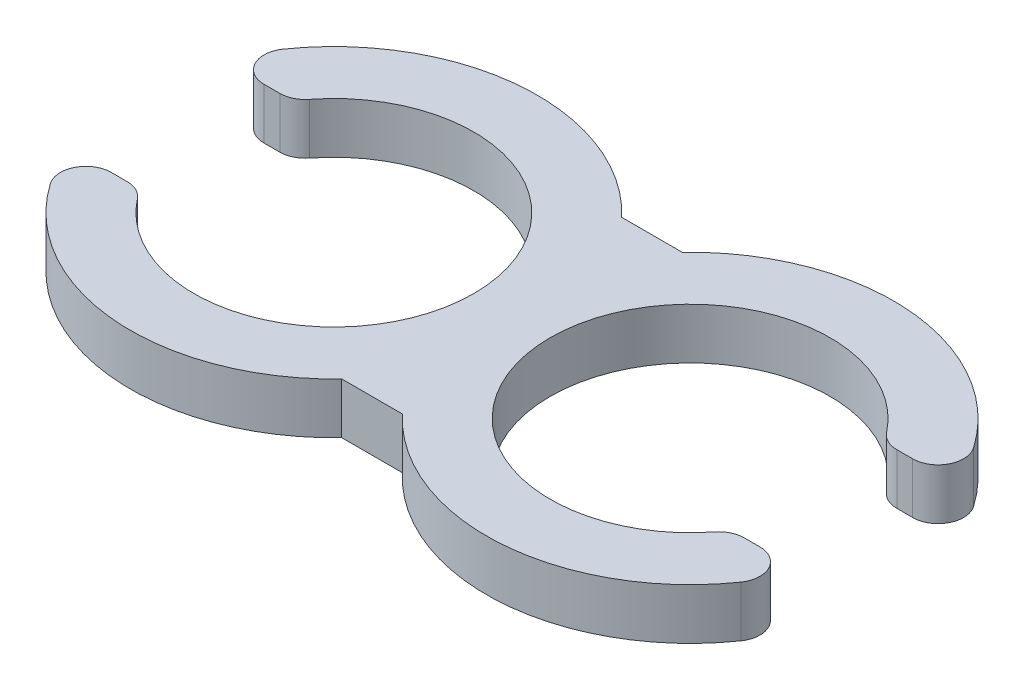
from build123d import *

# Parameters (mm, degrees)
BOSS_EXTRUDE1_DEPTH = 2
FILLET1_R           = 1
FILLET2_R           = 1


with BuildPart() as part:
    # Sketch1 → Boss-Extrude1 (new body)
    with BuildSketch(Plane(origin=(0, 0, 0), x_dir=(1, 0, 0), z_dir=(0, 1, 0))):
        with BuildLine():
            Line((11.609772229, 3), (14.416198487, 3))
            ThreePointArc((14.416198487, 3), (9.671814624, 7.540650278), (3.127016654, 7))
            Line((3.127016654, 7), (3.127016654, 5.5))
            Line((3.127016654, 5.5), (7, 5.5))
            ThreePointArc((7, 5.5), (9.62202212, 4.834769901), (11.609772229, 3))
        make_face()
        with BuildLine():
            Line((3.127016654, -5.5), (3.127016654, -7))
            ThreePointArc((3.127016654, -7), (9.671814624, -7.540650278), (14.416198487, -3))
            Line((14.416198487, -3), (11.609772229, -3))
            ThreePointArc((11.609772229, -3), (9.62202212, -4.834769901), (7, -5.5))
            Line((7, -5.5), (3.127016654, -5.5))
        make_face()
        with BuildLine():
            Line((3.127016654, -5.5), (1.190524981, -5.5))
            ThreePointArc((1.190524981, -5.5), (2.101020514, -6.32455532), (3.127016654, -7))
            Line((3.127016654, -7), (3.127016654, -5.5))
        make_face()
        with BuildLine():
            ThreePointArc((0, -3.872983346), (0.543804652, -4.72414454), (1.190524981, -5.5))
            Line((1.190524981, -5.5), (3.127016654, -5.5))
            Line((3.127016654, -5.5), (3.127016654, -3.905124838))
            ThreePointArc((3.127016654, -3.905124838), (2.734545947, -3.472160958), (2.390227771, -3))
            Line((2.390227771, -3), (0.416198487, -3))
            ThreePointArc((0.416198487, -3), (0.221303185, -3.442786708), (0, -3.872983346))
        make_face()
        with BuildLine():
            ThreePointArc((1, 0), (0.85269342, -1.5281381), (0.416198487, -3))
            Line((0.416198487, -3), (2.390227771, -3))
            ThreePointArc((2.390227771, -3), (1.5, 0), (2.390227771, 3))
            Line((2.390227771, 3), (0.416198487, 3))
            ThreePointArc((0.416198487, 3), (0.85269342, 1.5281381), (1, 0))
        make_face()
        with BuildLine():
            ThreePointArc((0, 3.872983346), (0.221303185, 3.442786708), (0.416198487, 3))
            Line((0.416198487, 3), (2.390227771, 3))
            ThreePointArc((2.390227771, 3), (2.734545947, 3.472160958), (3.127016654, 3.905124838))
            Line((3.127016654, 3.905124838), (3.127016654, 5.5))
            Line((3.127016654, 5.5), (1.190524981, 5.5))
            ThreePointArc((1.190524981, 5.5), (0.543804652, 4.72414454), (0, 3.872983346))
        make_face()
        with BuildLine():
            Line((1.190524981, 5.5), (-1.190524981, 5.5))
            ThreePointArc((-1.190524981, 5.5), (-0.543804652, 4.72414454), (0, 3.872983346))
            ThreePointArc((0, 3.872983346), (0.543804652, 4.72414454), (1.190524981, 5.5))
        make_face()
        with BuildLine():
            Line((-1.190524981, 5.5), (-3.127016654, 5.5))
            Line((-3.127016654, 5.5), (-3.127016654, 3.905124838))
            ThreePointArc((-3.127016654, 3.905124838), (-2.734545947, 3.472160958), (-2.390227771, 3))
            Line((-2.390227771, 3), (-0.416198487, 3))
            ThreePointArc((-0.416198487, 3), (-0.221303185, 3.442786708), (0, 3.872983346))
            ThreePointArc((0, 3.872983346), (-0.543804652, 4.72414454), (-1.190524981, 5.5))
        make_face()
        with BuildLine():
            ThreePointArc((-1.5, 0), (-1.727251795, -1.564648961), (-2.390227771, -3))
            Line((-2.390227771, -3), (-0.416198487, -3))
            ThreePointArc((-0.416198487, -3), (-1, 0), (-0.416198487, 3))
            Line((-0.416198487, 3), (-2.390227771, 3))
            ThreePointArc((-2.390227771, 3), (-1.727251795, 1.564648961), (-1.5, 0))
        make_face()
        with BuildLine():
            Line((-3.127016654, -3.905124838), (-3.127016654, -5.5))
            Line((-3.127016654, -5.5), (-1.190524981, -5.5))
            ThreePointArc((-1.190524981, -5.5), (-0.543804652, -4.72414454), (0, -3.872983346))
            ThreePointArc((0, -3.872983346), (-0.221303185, -3.442786708), (-0.416198487, -3))
            Line((-0.416198487, -3), (-2.390227771, -3))
            ThreePointArc((-2.390227771, -3), (-2.734545947, -3.472160958), (-3.127016654, -3.905124838))
        make_face()
        with BuildLine():
            ThreePointArc((0, -3.872983346), (-0.543804652, -4.72414454), (-1.190524981, -5.5))
            Line((-1.190524981, -5.5), (1.190524981, -5.5))
            ThreePointArc((1.190524981, -5.5), (0.543804652, -4.72414454), (0, -3.872983346))
        make_face()
        with BuildLine():
            ThreePointArc((-0.416198487, 3), (-1, 0), (-0.416198487, -3))
            Line((-0.416198487, -3), (0.416198487, -3))
            ThreePointArc((0.416198487, -3), (0.85269342, -1.5281381), (1, 0))
            ThreePointArc((1, 0), (0.85269342, 1.5281381), (0.416198487, 3))
            Line((0.416198487, 3), (-0.416198487, 3))
        make_face()
        with BuildLine():
            ThreePointArc((0, 3.872983346), (-0.221303185, 3.442786708), (-0.416198487, 3))
            Line((-0.416198487, 3), (0.416198487, 3))
            ThreePointArc((0.416198487, 3), (0.221303185, 3.442786708), (0, 3.872983346))
        make_face()
        with BuildLine():
            ThreePointArc((-0.416198487, -3), (-0.221303185, -3.442786708), (0, -3.872983346))
            ThreePointArc((0, -3.872983346), (0.221303185, -3.442786708), (0.416198487, -3))
            Line((0.416198487, -3), (-0.416198487, -3))
        make_face()
        with BuildLine():
            Line((-3.127016654, 5.5), (-7, 5.5))
            ThreePointArc((-7, 5.5), (-4.905744358, 5.085675305), (-3.127016654, 3.905124838))
            Line((-3.127016654, 3.905124838), (-3.127016654, 5.5))
        make_face()
        with BuildLine():
            Line((-14.416198487, 3), (-11.609772229, 3))
            ThreePointArc((-11.609772229, 3), (-9.62202212, 4.834769901), (-7, 5.5))
            Line((-7, 5.5), (-3.127016654, 5.5))
            Line((-3.127016654, 5.5), (-3.127016654, 7))
            ThreePointArc((-3.127016654, 7), (-9.671814624, 7.540650278), (-14.416198487, 3))
        make_face()
        with BuildLine():
            Line((-3.127016654, 7), (-3.127016654, 5.5))
            Line((-3.127016654, 5.5), (-1.190524981, 5.5))
            ThreePointArc((-1.190524981, 5.5), (-2.101020514, 6.32455532), (-3.127016654, 7))
        make_face()
        with BuildLine():
            Line((3.127016654, 5.5), (3.127016654, 7))
            ThreePointArc((3.127016654, 7), (2.101020514, 6.32455532), (1.190524981, 5.5))
            Line((1.190524981, 5.5), (3.127016654, 5.5))
        make_face()
        with BuildLine():
            Line((-1.190524981, -5.5), (-3.127016654, -5.5))
            Line((-3.127016654, -5.5), (-3.127016654, -7))
            ThreePointArc((-3.127016654, -7), (-2.101020514, -6.32455532), (-1.190524981, -5.5))
        make_face()
        with BuildLine():
            Line((-3.127016654, -5.5), (-7, -5.5))
            ThreePointArc((-7, -5.5), (-9.62202212, -4.834769901), (-11.609772229, -3))
            Line((-11.609772229, -3), (-14.416198487, -3))
            ThreePointArc((-14.416198487, -3), (-9.671814624, -7.540650278), (-3.127016654, -7))
            Line((-3.127016654, -7), (-3.127016654, -5.5))
        make_face()
        with BuildLine():
            ThreePointArc((-3.127016654, -3.905124838), (-4.905744358, -5.085675305), (-7, -5.5))
            Line((-7, -5.5), (-3.127016654, -5.5))
            Line((-3.127016654, -5.5), (-3.127016654, -3.905124838))
        make_face()
        with BuildLine():
            Line((7, 5.5), (3.127016654, 5.5))
            Line((3.127016654, 5.5), (3.127016654, 3.905124838))
            ThreePointArc((3.127016654, 3.905124838), (4.905744358, 5.085675305), (7, 5.5))
        make_face()
        with BuildLine():
            Line((3.127016654, -3.905124838), (3.127016654, -5.5))
            Line((3.127016654, -5.5), (7, -5.5))
            ThreePointArc((7, -5.5), (4.905744358, -5.085675305), (3.127016654, -3.905124838))
        make_face()
    extrude(amount=BOSS_EXTRUDE1_DEPTH)

    # Fillet1
    fillet1_edges = [part.edges().sort_by_distance(p)[0] for p in [
        (-14.416198487, 1, -3),
        (14.416198487, 1, -3),
        (14.416198487, 1, 3),
        (-14.416198487, 1, 3),
    ]]
    fillet(fillet1_edges, radius=FILLET1_R)

    # Fillet2
    fillet2_edges = [part.edges().sort_by_distance(p)[0] for p in [
        (-11.609772229, 1, 3),
        (-11.609772229, 1, -3),
        (11.609772229, 1, -3),
        (11.609772229, 1, 3),
    ]]
    fillet(fillet2_edges, radius=FILLET2_R)


solid = part.part
